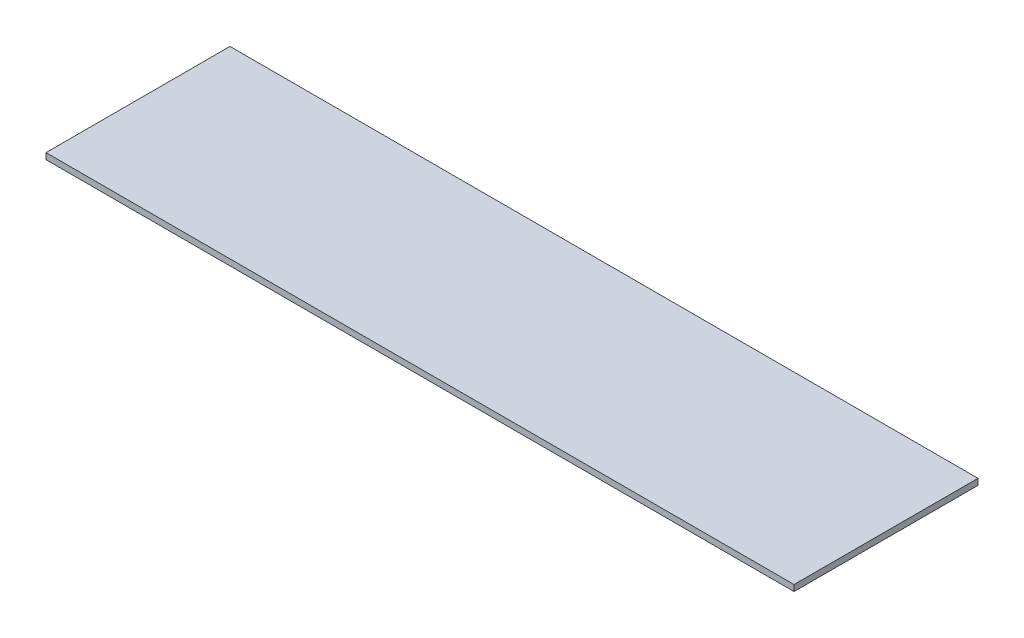
from build123d import *

# Parameters (mm, degrees)
SKETCH1_W           = 762
SKETCH1_H           = 177.8
BOSS_EXTRUDE1_DEPTH = 6.35
SKETCH5_W           = 774.7
SKETCH5_H           = 190.5
SKETCH5_W_2         = 762
SKETCH5_H_2         = 177.8
BOSS_EXTRUDE2_DEPTH = 6.35


with BuildPart() as part:
    # Sketch1 → Boss-Extrude1 (new body)
    with BuildSketch(Plane(origin=(0, 0, 0), x_dir=(1, 0, 0), z_dir=(0, 1, 0))):
        Rectangle(SKETCH1_W, SKETCH1_H)
    extrude(amount=BOSS_EXTRUDE1_DEPTH)

    # Sketch5 → Boss-Extrude2 (add)
    with BuildSketch(Plane(origin=(0, 6.35, 0), x_dir=(1, 0, 0), z_dir=(0, 1, 0))):
        Rectangle(SKETCH5_W, SKETCH5_H)
        Rectangle(SKETCH5_W_2, SKETCH5_H_2, mode=Mode.SUBTRACT)
    extrude(amount=-BOSS_EXTRUDE2_DEPTH)


solid = part.part
